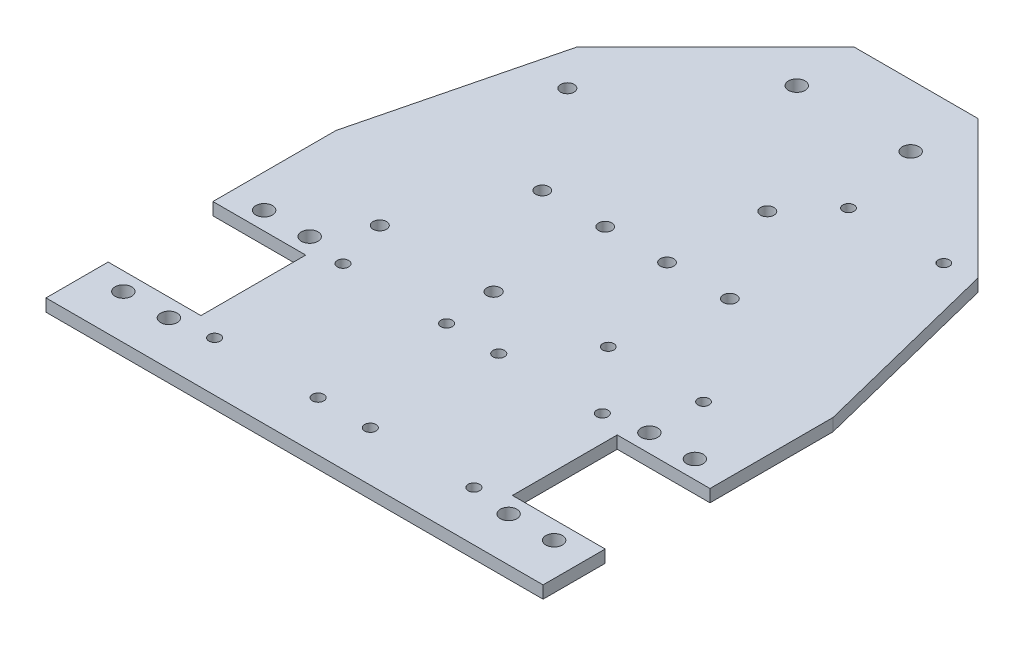
from build123d import *

# Parameters (mm, degrees)
BOSS_EXTRUDE1_DEPTH     = 3
CUT_EXTRUDE1_DEPTH      = 10
CUT_EXTRUDE1_DEPTH_BACK = 10
SKETCH2_R               = 1.375
CUT_EXTRUDE2_DEPTH      = 10
CUT_EXTRUDE2_DEPTH_BACK = 10
SKETCH4_R               = 1.6086033
SKETCH4_R_2             = 1.6
SKETCH4_R_3             = 1.600016576
SKETCH4_R_4             = 1.599999999
CUT_EXTRUDE3_DEPTH      = 5
CUT_EXTRUDE3_DEPTH_BACK = 5
SKETCH5_R               = 2
SKETCH5_R_2             = 1.996887868
CHAMFER1_SIZE           = 25
CHAMFER1_SIZE2          = 34.359213547
CUT_EXTRUDE4_DEPTH      = 10
CUT_EXTRUDE4_DEPTH_BACK = 10
SKETCH6_R               = 1.631965818
SKETCH6_R_2             = 1.621215412
SKETCH6_R_3             = 1.651492617
SKETCH6_R_4             = 1.62625173
CUT_EXTRUDE5_DEPTH      = 10
CUT_EXTRUDE5_DEPTH_BACK = 10
SKETCH7_R               = 1.35
CUT_EXTRUDE6_DEPTH      = 10
CUT_EXTRUDE6_DEPTH_BACK = 10
SKETCH8_R               = 2


with BuildPart() as part:
    # Sketch1 → Boss-Extrude1 (new body)
    with BuildSketch(Plane(origin=(0, 0, 0), x_dir=(1, 0, 0), z_dir=(0, 1, 0))):
        Polygon((-60, 15), (-60, 0), (60, 0), (60, 15), (37.6, 15), (37.6, 40.3), (60, 40.3), (60, 70), (40, 150), (-40, 150), (-60, 70), (-60, 40.3), (-37.6, 40.3), (-37.6, 15), align=None)
    extrude(amount=BOSS_EXTRUDE1_DEPTH)

    # Sketch2 → Cut-Extrude1 (cut, two sides: drawn at the far end of the back side and taken through both)
    with BuildSketch(Plane(origin=(0, 3, 0), x_dir=(1, 0, 0), z_dir=(0, 1, 0)).offset(-CUT_EXTRUDE1_DEPTH_BACK)):
        with Locations((-31.3, 43)):
            Circle(SKETCH2_R)
        with Locations((-6.3, 43)):
            Circle(SKETCH2_R)
        with Locations((-6.3, 12)):
            Circle(SKETCH2_R)
        with Locations((-31.3, 12)):
            Circle(SKETCH2_R)
        with Locations((6.3, 43)):
            Circle(SKETCH2_R)
        with Locations((31.3, 43)):
            Circle(SKETCH2_R)
        with Locations((31.3, 12)):
            Circle(SKETCH2_R)
        with Locations((6.3, 12)):
            Circle(SKETCH2_R)
    extrude(amount=CUT_EXTRUDE1_DEPTH + CUT_EXTRUDE1_DEPTH_BACK, mode=Mode.SUBTRACT)

    # Sketch4 → Cut-Extrude2 (cut, two sides: drawn at the far end of the back side and taken through both)
    with BuildSketch(Plane(origin=(0, 3, 0), x_dir=(1, 0, 0), z_dir=(0, 1, 0)).offset(-CUT_EXTRUDE2_DEPTH_BACK)):
        with Locations((-22.548030216, 82.366514772)):
            Circle(SKETCH4_R)
        with Locations((-7.372652758, 82.375044524)):
            Circle(SKETCH4_R_2)
        with Locations((22.726359118, 82.375056093)):
            Circle(SKETCH4_R_3)
        with Locations((7.549847242, 82.375044524)):
            Circle(SKETCH4_R_4)
    extrude(amount=CUT_EXTRUDE2_DEPTH + CUT_EXTRUDE2_DEPTH_BACK, mode=Mode.SUBTRACT)

    # Sketch5 → Cut-Extrude3 (cut, two sides: drawn at the far end of the back side and taken through both)
    with BuildSketch(Plane(origin=(0, 3, 0), x_dir=(1, 0, 0), z_dir=(0, 1, 0)).offset(-CUT_EXTRUDE3_DEPTH_BACK)):
        with Locations((-51.988593255, 44.648942023)):
            Circle(SKETCH5_R)
        with Locations((-40.988593255, 44.648942023)):
            Circle(SKETCH5_R)
        with Locations((-51.988593255, 10.65981673)):
            Circle(SKETCH5_R)
        with Locations((-40.988593255, 10.65981673)):
            Circle(SKETCH5_R)
        with Locations((41.011406745, 10.65981673)):
            Circle(SKETCH5_R)
        with Locations((52.011406745, 10.65981673)):
            Circle(SKETCH5_R)
        with Locations((52.011406745, 44.648942023)):
            Circle(SKETCH5_R)
        with Locations((41.01131511, 44.652052806)):
            Circle(SKETCH5_R_2)
    extrude(amount=CUT_EXTRUDE3_DEPTH + CUT_EXTRUDE3_DEPTH_BACK, mode=Mode.SUBTRACT)

    # Chamfer1
    chamfer1_edges = [part.edges().sort_by_distance(p)[0] for p in [
        (-40, 1.5, -150),
        (40, 1.5, -150),
    ]]
    chamfer1_side = [part.faces().sort_by_distance(p)[0] for p in [
        (0, 1.5, -150),
    ]]
    chamfer(chamfer1_edges, length=CHAMFER1_SIZE, length2=CHAMFER1_SIZE2, reference=chamfer1_side[0])

    # Sketch6 → Cut-Extrude4 (cut, two sides: drawn at the far end of the back side and taken through both)
    with BuildSketch(Plane(origin=(0, 3, 0), x_dir=(1, 0, 0), z_dir=(0, 1, 0)).offset(-CUT_EXTRUDE4_DEPTH_BACK)):
        with Locations((-40.900357492, 106.752555334)):
            Circle(SKETCH6_R)
        with Locations((8.961819516, 105.164972563)):
            Circle(SKETCH6_R_2)
        with Locations((-7.264004675, 55.319530138)):
            Circle(SKETCH6_R_3)
        with Locations((-34.862659576, 55.442184264)):
            Circle(SKETCH6_R_4)
    extrude(amount=CUT_EXTRUDE4_DEPTH + CUT_EXTRUDE4_DEPTH_BACK, mode=Mode.SUBTRACT)

    # Sketch7 → Cut-Extrude5 (cut, two sides: drawn at the far end of the back side and taken through both)
    with BuildSketch(Plane(origin=(0, 3, 0), x_dir=(1, 0, 0), z_dir=(0, 1, 0)).offset(-CUT_EXTRUDE5_DEPTH_BACK)):
        with Locations((18.097012052, 115.64214419)):
            Circle(SKETCH7_R)
        with Locations((41.097012052, 115.64214419)):
            Circle(SKETCH7_R)
        with Locations((18.097012052, 57.64214419)):
            Circle(SKETCH7_R)
        with Locations((41.097012052, 57.64214419)):
            Circle(SKETCH7_R)
    extrude(amount=CUT_EXTRUDE5_DEPTH + CUT_EXTRUDE5_DEPTH_BACK, mode=Mode.SUBTRACT)

    # Sketch8 → Cut-Extrude6 (cut, two sides: drawn at the far end of the back side and taken through both)
    with BuildSketch(Plane.XZ.offset(-CUT_EXTRUDE6_DEPTH_BACK)):
        with Locations((13.75, -135)):
            Circle(SKETCH8_R)
        with Locations((-13.75, -135)):
            Circle(SKETCH8_R)
    extrude(amount=CUT_EXTRUDE6_DEPTH + CUT_EXTRUDE6_DEPTH_BACK, mode=Mode.SUBTRACT)


solid = part.part
